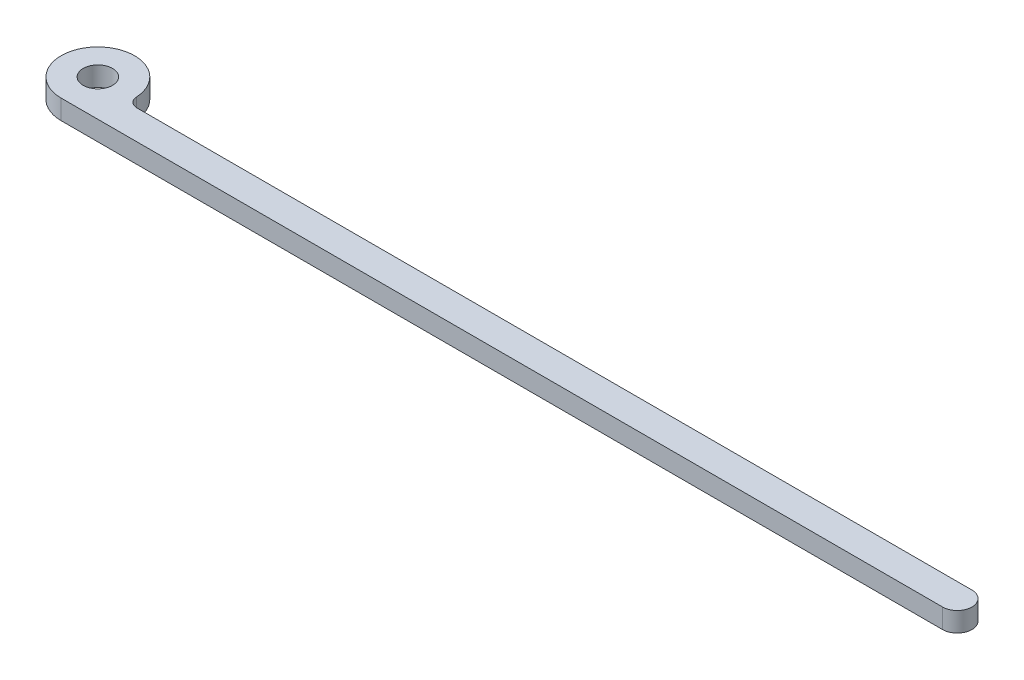
from build123d import *

# Parameters (mm, degrees)
SKETCH1_R           = 3
BOSS_EXTRUDE1_DEPTH = 2
FILLET1_R           = 2


with BuildPart() as part:
    # Sketch1 → Boss-Extrude1 (new, symmetric)
    with BuildSketch(Plane(origin=(0, 0, 0), x_dir=(1, 0, 0), z_dir=(0, 1, 0))):
        with BuildLine():
            Line((0, -7.5), (180, -7.5))
            ThreePointArc((180, -7.5), (183, -4.5), (180, -1.5))
            Line((180, -1.5), (7.348469228, -1.5))
            ThreePointArc((7.348469228, -1.5), (-4.74341649, 5.809475019), (0, -7.5))
        make_face()
        with Locations(Location((0, 0, 0), (0, 0, 270))):
            Circle(SKETCH1_R, mode=Mode.SUBTRACT)
    extrude(amount=BOSS_EXTRUDE1_DEPTH, both=True)

    # Fillet1
    fillet1_edges = [part.edges().sort_by_distance(p)[0] for p in [
        (7.348469228, 0, 1.5),
    ]]
    fillet(fillet1_edges, radius=FILLET1_R)


solid = part.part
